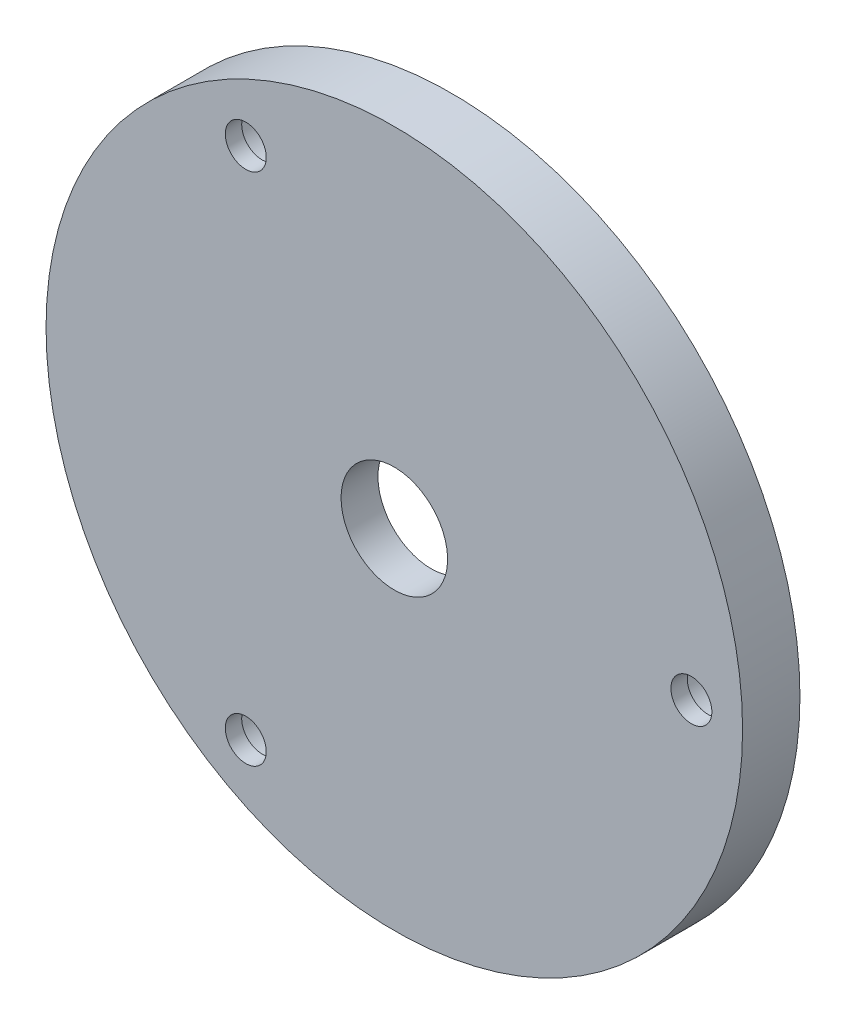
from build123d import *

# Parameters (mm, degrees)
SKETCH_1_W                    = 85
SKETCH_1_H                    = 14
HOLE_WIZARD_M24_1_D           = 26
HOLE_WIZARD_M24_1_CBORE_D     = 120
HOLE_WIZARD_M24_1_CBORE_DEPTH = 5
HOLE_WIZARD_M8_1_D            = 10
HOLE_WIZARD_M8_1_CBORE_D      = 16
HOLE_WIZARD_M8_1_CBORE_DEPTH  = 10


with BuildPart() as part:
    # 草图1 → 旋转1 (revolve)
    with BuildSketch(Plane(origin=(0, 0, 0), x_dir=(1, 0, 0), z_dir=(0, 1, 0))):
        with Locations((42.5, -7)):
            Rectangle(SKETCH_1_W, SKETCH_1_H)
    revolve(axis=Axis((0, 0, 0), (0, 0, 1)))

    # M24 六角头螺栓的柱形沉头孔1 (through all)
    with Locations(Plane(origin=(0, 0, 0), x_dir=(-1, 0, 0), z_dir=(0, 0, -1))):
        with Locations((0, 0)):
            CounterBoreHole(HOLE_WIZARD_M24_1_D / 2, HOLE_WIZARD_M24_1_CBORE_D / 2, HOLE_WIZARD_M24_1_CBORE_DEPTH)

    # M8 六角头螺栓的柱形沉头孔1 (through all)
    with Locations(Plane(origin=(0, 0, 0), x_dir=(-1, 0, 0), z_dir=(0, 0, -1))):
        with Locations((36.25, 62.786841774), (-72.5, 0), (36.25, -62.786841774)):
            CounterBoreHole(HOLE_WIZARD_M8_1_D / 2, HOLE_WIZARD_M8_1_CBORE_D / 2, HOLE_WIZARD_M8_1_CBORE_DEPTH)


solid = part.part
